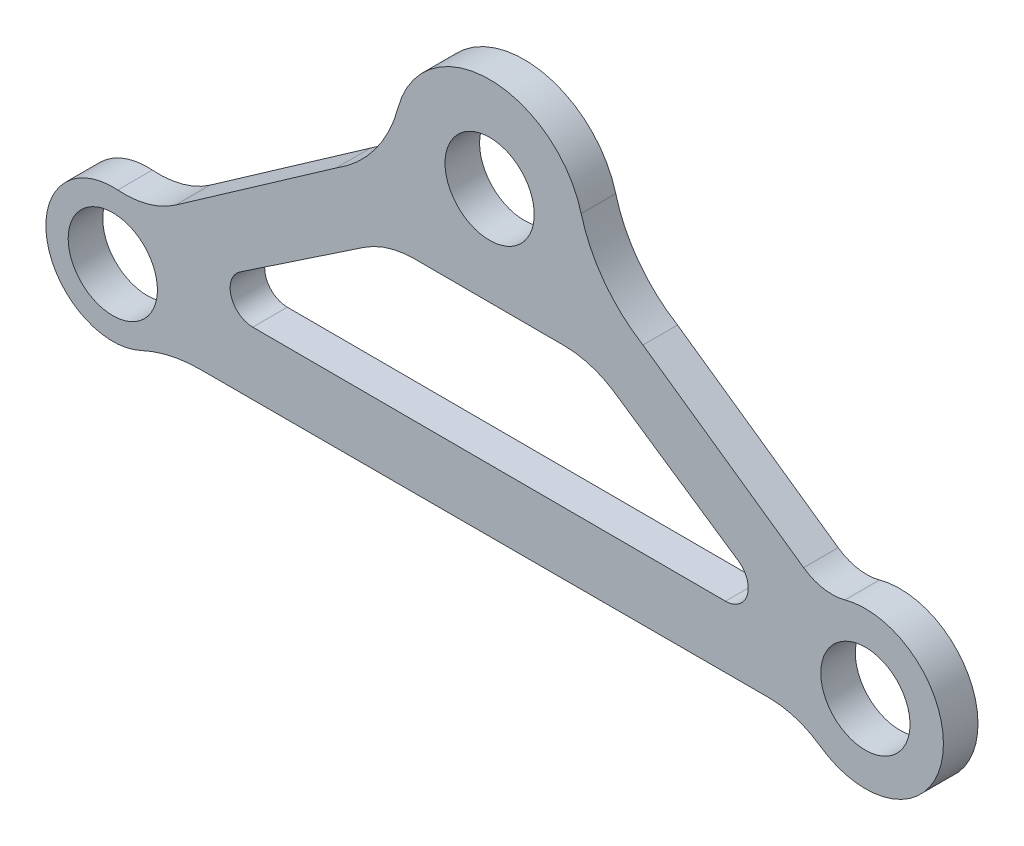
from build123d import *

# Parameters (mm, degrees)
SKETCH1_R           = 8
BOSS_EXTRUDE5_DEPTH = 6.2


with BuildPart() as part:
    # Sketch1 → Boss-Extrude5 (new body)
    with BuildSketch(Plane.XY):
        with BuildLine():
            Line((56.326485312, -30.684522316), (27.5, -10.5))
            ThreePointArc((27.5, -10.5), (20.534538743, -4.128471677), (16.428279646, 4.371684787))
            ThreePointArc((16.428279646, 4.371684787), (0, 17), (-16.428279646, 4.371684787))
            ThreePointArc((-16.428279646, 4.371684787), (-20.534538743, -4.128471677), (-27.5, -10.5))
            Line((-27.5, -10.5), (-56.326485312, -30.684522316))
            ThreePointArc((-56.326485312, -30.684522316), (-61.265597018, -33.006583144), (-66.697832686, -33.533466974))
            ThreePointArc((-66.697832686, -33.533466974), (-79.395490057, -47.670549132), (-62.498849309, -56.364864865))
            ThreePointArc((-62.498849309, -56.364864865), (-57.322133361, -54.598377325), (-51.885147908, -54))
            Line((-51.885147908, -54), (50.093284326, -54))
            ThreePointArc((50.093284326, -54), (54.937524893, -54.750956314), (59.327038829, -56.933333333))
            ThreePointArc((59.327038829, -56.933333333), (81.19137471, -47.945254568), (63.752518972, -31.985271674))
            ThreePointArc((63.752518972, -31.985271674), (59.894931525, -32.160256826), (56.326485312, -30.684522316))
        make_face()
        with Locations(Location((67.406574019, -45.5, 0), (0, 0, 180))):
            Circle(SKETCH1_R, mode=Mode.SUBTRACT)
        with Locations(Location((0, 0, 0), (0, 0, 180))):
            Circle(SKETCH1_R, mode=Mode.SUBTRACT)
        with Locations(Location((-67.593425981, -45.5, 0), (0, 0, 180))):
            Circle(SKETCH1_R, mode=Mode.SUBTRACT)
        with BuildLine():
            Line((13.373633763, -17.668465774), (-13.446021539, -17.613430543))
            ThreePointArc((-13.446021539, -17.613430543), (-18.208444632, -18.31519172), (-22.557597192, -20.378687414))
            Line((-22.557597192, -20.378687414), (-44.744358674, -35.277702309))
            ThreePointArc((-44.744358674, -35.277702309), (-46.370360965, -39.839621324), (-42.483173297, -42.728351249))
            Line((-42.483173297, -42.728351249), (42.307503535, -42.902337904))
            ThreePointArc((42.307503535, -42.902337904), (46.206513764, -40.029584072), (44.599245091, -35.46103039))
            Line((44.599245091, -35.46103039), (22.473807978, -20.471098353))
            ThreePointArc((22.473807978, -20.471098353), (18.133148836, -18.389767499), (13.373633763, -17.668465774))
        make_face(mode=Mode.SUBTRACT)
    extrude(amount=BOSS_EXTRUDE5_DEPTH)


solid = part.part
